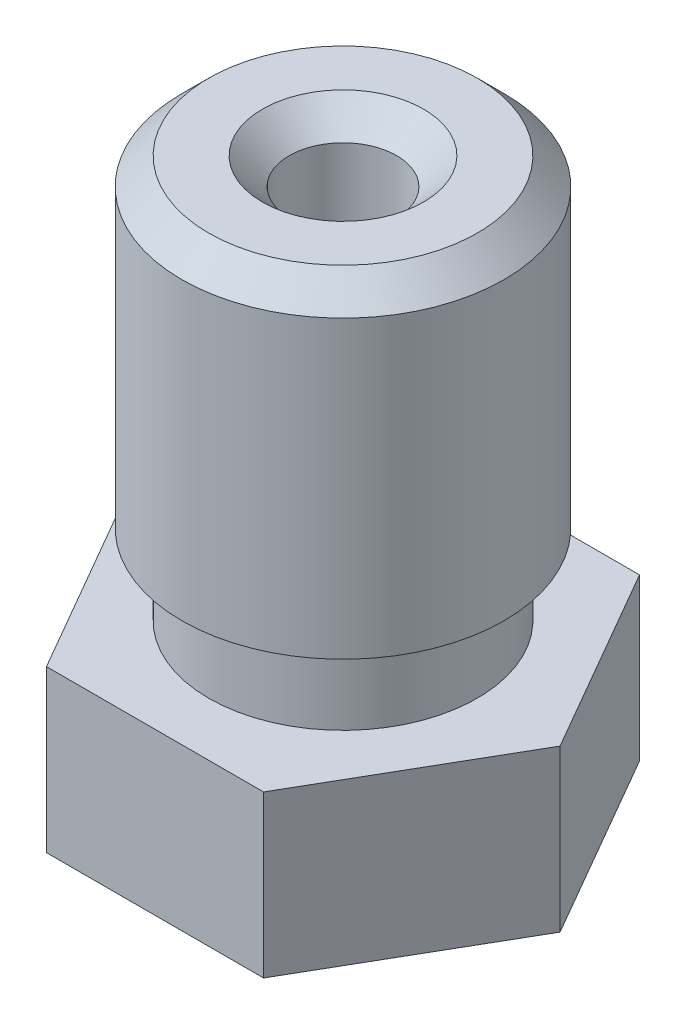
from build123d import *

# Parameters (mm, degrees)
BOSS_EXTRUDE1_DEPTH = 3
CHAMFER1_SIZE       = 0.5


with BuildPart() as part:
    # Sketch1 → Boss-Extrude1 (new body)
    with BuildSketch(Plane.XZ):
        Polygon((-2.020725942, 3.5), (-4.041451884, 0), (-2.020725942, -3.5), (2.020725942, -3.5), (4.041451884, 0), (2.020725942, 3.5), align=None)
    extrude(amount=-BOSS_EXTRUDE1_DEPTH)

    # Sketch2 → Revolve1 (revolve)
    with BuildSketch(Plane(origin=(0, 0, 0), x_dir=(-1, 0, 0), z_dir=(0, 0, -1)), mode=Mode.PRIVATE) as revolve1_sk:
        Polygon((-2.5, 3), (0, 3), (0, 10.5), (-3, 10.5), (-3, 4.5), (-2.5, 4.5), align=None)
    revolve(revolve1_sk.sketch.rotate(Axis((0, 3, 0), (0, 1, 0)), 270), axis=Axis((0, 3, 0), (0, 1, 0)))

    # Sketch3 → Revolve2 (revolve)
    with BuildSketch(Plane.XY, mode=Mode.PRIVATE) as revolve2_sk:
        Polygon((2.5, 0), (0, 0), (0, -2), (0.5, -2), align=None)
    revolve(revolve2_sk.sketch.rotate(Axis((0, 0, 0), (0, -1, 0)), 180), axis=Axis((0, 0, 0), (0, -1, 0)))

    # Sketch4 → Cut-Revolve1 (revolve, cut)
    with BuildSketch(Plane(origin=(0, 0, 0), x_dir=(-1, 0, 0), z_dir=(0, 0, -1)), mode=Mode.PRIVATE) as cut_revolve1_sk:
        Polygon((-0.2, -2), (0, -2), (0, 10.5), (-1, 10.5), (-1, 0), (-0.75, -0.227272727), (-0.75, -0.7), (-0.2, -1.2), align=None)
    revolve(cut_revolve1_sk.sketch.rotate(Axis((0, -2, 0), (0, 1, 0)), 270), axis=Axis((0, -2, 0), (0, 1, 0)), mode=Mode.SUBTRACT)

    # Chamfer1
    chamfer1_edges = [part.edges().sort_by_distance(p)[0] for p in [
        (0, 10.5, -3),
        (0, 10.5, -1),
    ]]
    chamfer(chamfer1_edges, length=CHAMFER1_SIZE)


solid = part.part
